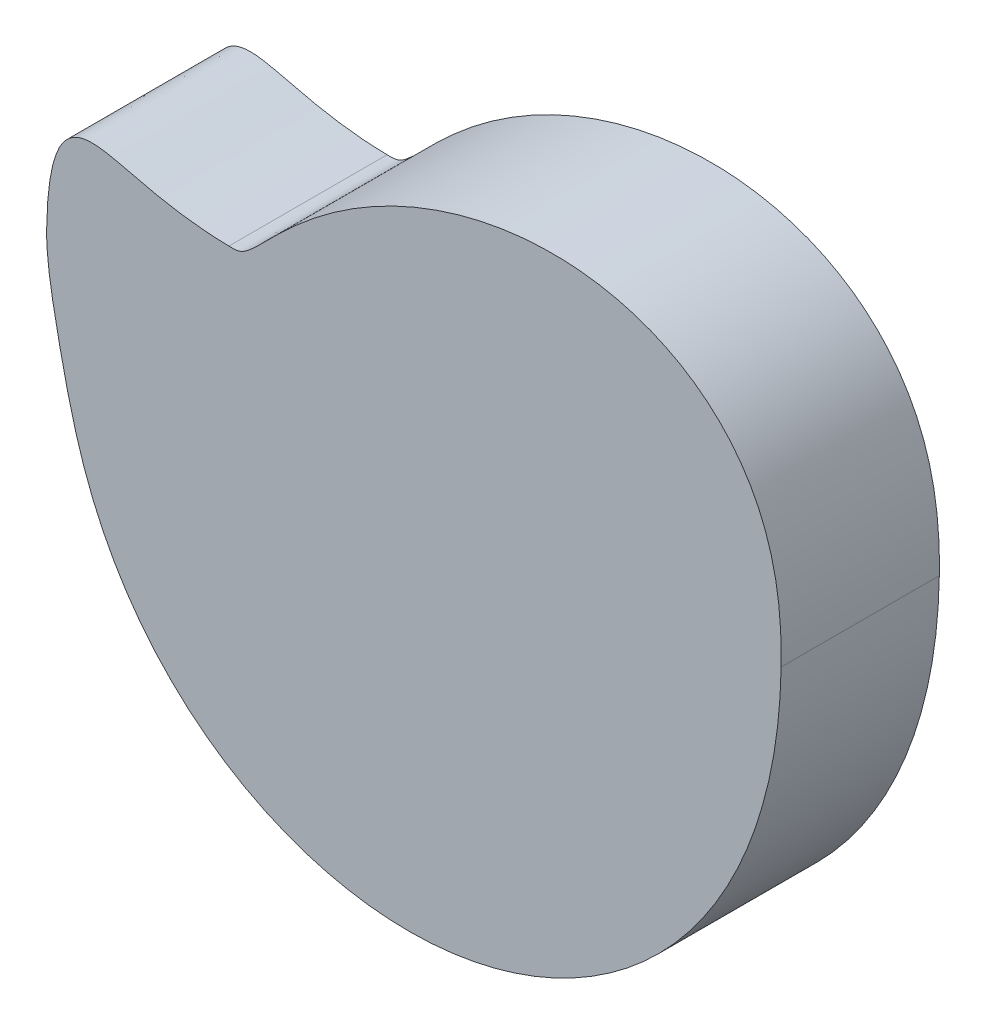
from build123d import *

# Parameters (mm, degrees)
EXTRUDE_1_DEPTH = 20


with BuildPart() as part:
    # 草图1 → 凸台-拉伸1 (new body)
    with BuildSketch(Plane.XY):
        with BuildLine():
            add(Edge.make_bspline(
                [(0.1782615, 10.530949408), (0.244905956, 10.529820254), (0.373277942, 10.526166579), (0.643494696, 10.518976505), (0.913729923, 10.526148962), (1.200031091, 10.559185531), (1.435848158, 10.617577351), (1.652398555, 10.691643298), (1.834684147, 10.772656816), (2.052105151, 10.886305872), (2.295740872, 11.038926219), (2.564460118, 11.233352073), (2.854933744, 11.46958407), (3.136732321, 11.716538458), (3.411752909, 11.970636797), (3.682474487, 12.229506357), (3.949993331, 12.49153421), (4.22064519, 12.760597645), (4.495024593, 13.035947777), (4.844773386, 13.388476486), (5.270316228, 13.817723931), (5.768446172, 14.316873279), (6.342050596, 14.882995744), (6.921243381, 15.443409674), (7.653194676, 16.135610087), (8.545252652, 16.951575587), (9.607212819, 17.879937478), (10.850479481, 18.906102669), (12.123049496, 19.895709066), (13.74951133, 21.0853332), (15.422127052, 22.209859592), (17.481595844, 23.478045633), (19.602324769, 24.640906966), (21.768702068, 25.716405622), (24.357662627, 26.838830596), (27.0029106, 27.823684354), (30.09318627, 28.749849662), (33.239288381, 29.464390668), (37.22590063, 30.075937896), (42.065752958, 30.328213523), (46.908766399, 29.914732573), (51.620118242, 28.738015133), (55.028998218, 27.341240068), (57.254744471, 26.158422471), (59.367744966, 24.787495607), (61.057163752, 23.46160968), (62.603150868, 21.998642749), (63.992654496, 20.414617159), (65.038768829, 19.031803865), (66.031894789, 17.501387154), (66.94993907, 15.820888181), (67.733993982, 14.073225246), (68.385975537, 12.273456792), (68.893244002, 10.520683159), (69.279207207, 8.832488895), (69.538203351, 7.335420706), (69.708734678, 6.051577951), (69.818803784, 4.966977753), (69.889135771, 4.117610885), (69.94180325, 3.226613382), (69.97981372, 2.406602606), (70.001013479, 1.464318305), (70.012058201, 0.725529174), (70.006690258, -0.082955575), (70.00209468, -0.459652906), (69.99881114, -0.653452585)],
                knots=[0.015449276, 0.015449276, 0.015449276, 0.015449276, 0.015449276, 0.01826057, 0.021071864, 0.023883158, 0.026694452, 0.028590807, 0.030487162, 0.032383517, 0.034279872, 0.037814277, 0.041348682, 0.044883086, 0.048417491, 0.051951896, 0.0554863, 0.059020705, 0.062555109, 0.066358102, 0.070161094, 0.077767079, 0.085373064, 0.092979049, 0.100585034, 0.108191019, 0.123402989, 0.138614969, 0.153826948, 0.169038928, 0.184250907, 0.21467495, 0.229886972, 0.260311058, 0.275523123, 0.305947253, 0.3363713, 0.366795348, 0.397219398, 0.427643449, 0.488491589, 0.549339602, 0.579763675, 0.610187749, 0.62726714, 0.644346531, 0.674770404, 0.691120756, 0.707471107, 0.723821359, 0.740171611, 0.759932386, 0.77969316, 0.796043438, 0.812393717, 0.828743995, 0.845094274, 0.853269416, 0.861444557, 0.869619699, 0.87779484, 0.885969982, 0.894145124, 0.902320265, 0.910495407, 0.910495407, 0.910495407, 0.910495407, 0.910495407], degree=4))
            add(Edge.make_bspline(
                [(69.99881114, -0.653452585), (69.996280261, -0.802829052), (69.990220853, -1.094587444), (69.974262699, -1.739186127), (69.950614641, -2.338367317), (69.910023626, -3.234121954), (69.848792011, -4.234888343), (69.75631235, -5.444726115), (69.622822759, -6.798518087), (69.460461294, -8.16341537), (69.269241478, -9.516272467), (69.048591267, -10.869613368), (68.798317634, -12.214791949), (68.51803424, -13.555862277), (68.207509036, -14.889153843), (67.866456245, -16.215638335), (67.494664866, -17.533434792), (67.091923133, -18.842353338), (66.658066663, -20.141146031), (66.192951642, -21.429166121), (65.696473242, -22.705379393), (65.036577726, -24.28483031), (63.896811051, -26.775631023), (62.449317335, -29.498835527), (60.632629255, -32.404693524), (58.612398649, -35.170251359), (56.876731263, -37.29032308), (54.554367978, -39.823032506), (51.543500376, -42.641785053), (47.725127379, -45.575040694), (42.992909396, -48.381256287), (37.937318134, -50.59827003), (32.6159065, -52.176501916), (27.10724651, -53.069906349), (21.499603375, -53.244171337), (15.916851924, -52.686629232), (10.454869475, -51.40374763), (5.208053204, -49.416193532), (0.266965944, -46.758244903), (-3.715134522, -43.887145704), (-6.83716953, -41.073562748), (-9.224802586, -38.515796464), (-10.999545938, -36.351159197), (-12.730439827, -33.942848801), (-14.383065646, -31.281261334), (-15.843934258, -28.509409456), (-17.114687718, -25.646281173), (-18.157539615, -22.870574622), (-19.01269195, -20.206230804), (-19.75637215, -17.508992091), (-20.413375584, -14.789664211), (-20.938223955, -12.398924973), (-21.36764808, -10.345379291), (-21.711948257, -8.63134203), (-21.976568128, -7.257929607), (-22.197140145, -6.036814566), (-22.373829461, -4.968003182), (-22.509993873, -4.052765909), (-22.611425299, -3.291473614), (-22.699351827, -2.52923668), (-22.771614833, -1.763997625), (-22.819281051, -1.095488164), (-22.845158008, -0.565511189), (-22.857714726, -0.185256379), (-22.863192914, 0.053126364), (-22.866051208, 0.248202442), (-22.867303132, 0.450386942), (-22.867007355, 0.654111362), (-22.865832001, 0.794250234), (-22.864680741, 0.878041738), (-22.863971236, 0.91991782)],
                knots=[0.087286735, 0.087286735, 0.087286735, 0.087286735, 0.087286735, 0.091089137, 0.09489154, 0.098693942, 0.102496344, 0.110101149, 0.117705954, 0.125310758, 0.132915563, 0.140520367, 0.148125172, 0.155729978, 0.163334784, 0.17093959, 0.178544396, 0.186149203, 0.193754009, 0.201358815, 0.208963621, 0.216568426, 0.224173231, 0.239382842, 0.269802062, 0.285011676, 0.30022129, 0.315430903, 0.330640517, 0.36131062, 0.391729917, 0.422149114, 0.452568309, 0.483639973, 0.514711605, 0.545783189, 0.576854883, 0.607926525, 0.638998112, 0.670069826, 0.701141369, 0.71667727, 0.732213171, 0.747748966, 0.763284761, 0.782521143, 0.801757525, 0.817293317, 0.832829109, 0.848364901, 0.863900694, 0.879436447, 0.8949722, 0.902740076, 0.910507953, 0.918275829, 0.926043706, 0.930307556, 0.934571406, 0.938835256, 0.943099106, 0.947362956, 0.951626806, 0.953758731, 0.954824693, 0.955890656, 0.956956618, 0.958022581, 0.959088543, 0.960154506, 0.960154506, 0.960154506, 0.960154506, 0.960154506], degree=4))
            add(Edge.make_bspline(
                [(-22.863971236, 0.91991782), (-22.722820821, 9.250836117), (-18.66633118, 16.402628203), (-10.300319867, 10.708487593), (0.1782615, 10.530949408)],
                knots=[0, 0, 0, 0, 0.398074449, 1, 1, 1, 1], degree=3))
        make_face()
    extrude(amount=EXTRUDE_1_DEPTH)


solid = part.part
